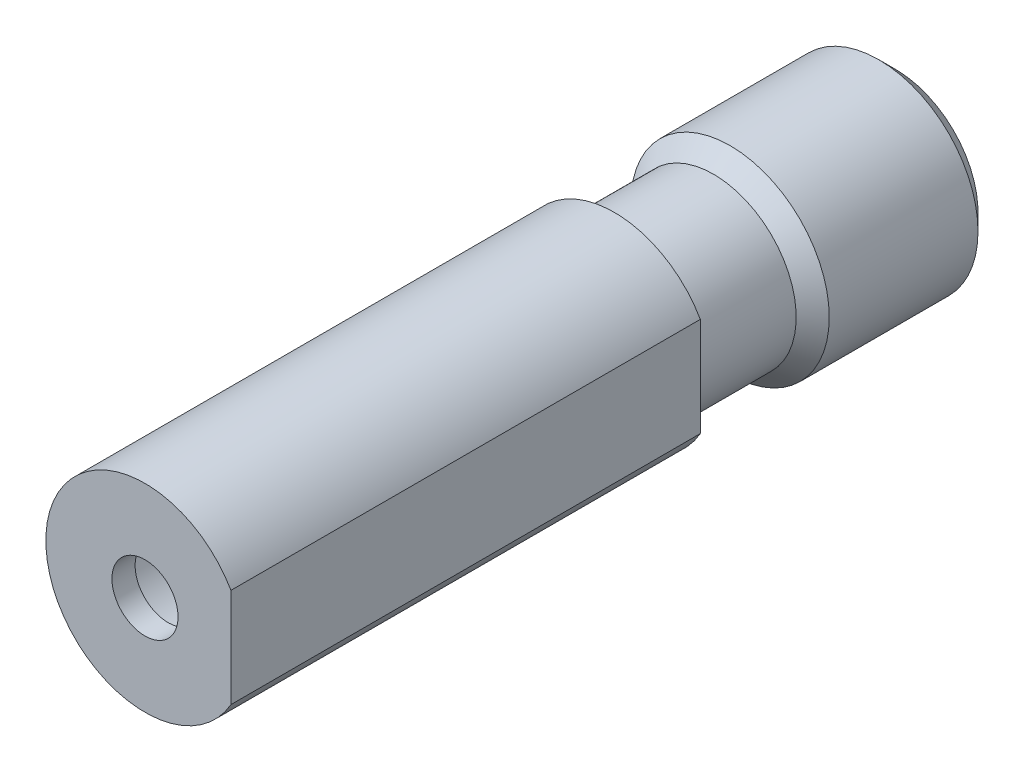
from build123d import *

# Parameters (mm, degrees)
EXTRUDE_1_DEPTH               = 14.2
HOLE_WIZARD_M1_61_D           = 2
HOLE_WIZARD_M1_61_CBORE_D     = 4
HOLE_WIZARD_M1_61_CBORE_DEPTH = 22
CHAMFER_1_SIZE                = 0.5


with BuildPart() as part:
    # Эскиз1 → Бобышка-Вытянуть1 (new body)
    with BuildSketch(Plane(origin=(0, 0, 8.5), x_dir=(-1, 0, 0), z_dir=(0, 0, -1))):
        with BuildLine():
            Line((-2.6, 1.496662955), (-2.6, -1.496662955))
            ThreePointArc((-2.6, -1.496662955), (3, 0), (-2.6, 1.496662955))
        make_face()
    extrude(amount=-EXTRUDE_1_DEPTH)

    # Эскиз2 → Повернуть1 (revolve)
    with BuildSketch(Plane.XZ, mode=Mode.PRIVATE) as revolve_1_sk:
        Polygon((2.5, 8.5), (0, 8.5), (0, 0), (3, 0), (3, 5), (2.5, 5.5), align=None)
    revolve(revolve_1_sk.sketch.rotate(Axis((0, 0, 8.5), (0, 0, -1)), 180), axis=Axis((0, 0, 8.5), (0, 0, -1)))

    # Цековка для винта с внутренним шестигранником M1.61 (through all)
    with Locations(Plane(origin=(0, 0, 0), x_dir=(-1, 0, 0), z_dir=(0, 0, -1))):
        with Locations((0, 0)):
            CounterBoreHole(HOLE_WIZARD_M1_61_D / 2, HOLE_WIZARD_M1_61_CBORE_D / 2, HOLE_WIZARD_M1_61_CBORE_DEPTH)

    # Фаска1
    chamfer_1_edges = [part.edges().sort_by_distance(p)[0] for p in [
        (3, 0, 0),
    ]]
    chamfer(chamfer_1_edges, length=CHAMFER_1_SIZE)


solid = part.part
